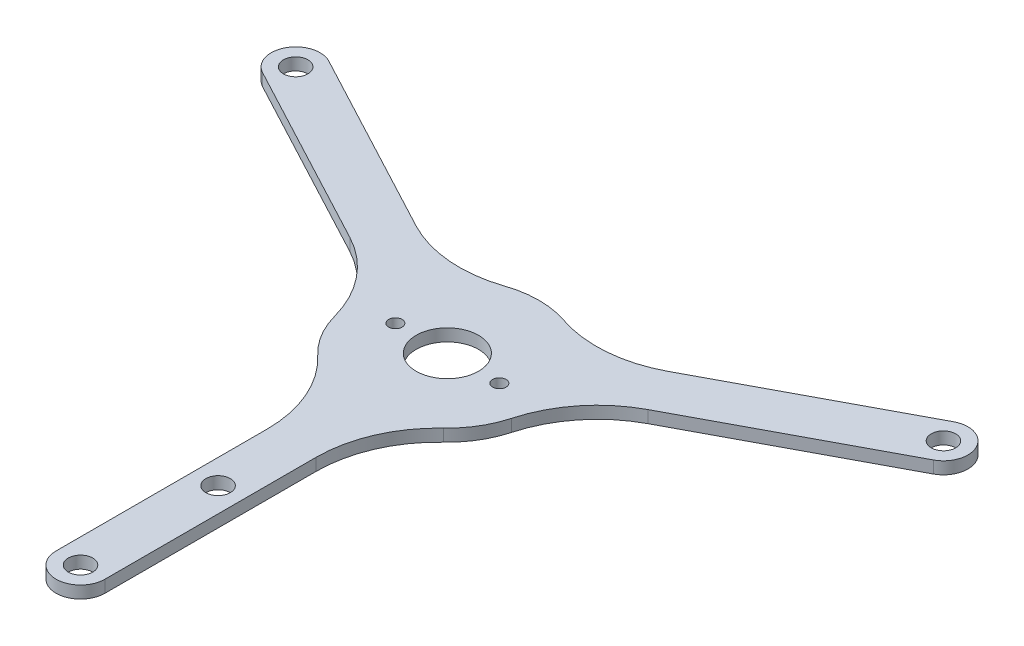
from build123d import *

# Parameters (mm, degrees)
SKETCH_1_R      = 2
SKETCH_1_R_2    = 1.1
SKETCH_1_R_3    = 5.1
EXTRUDE_1_DEPTH = 2
FILLET_1_R      = 20


with BuildPart() as part:
    # ｽｹｯﾁ1 → ﾎﾞｽ - 押し出し1 (new body)
    with BuildSketch(Plane(origin=(0, 0, 0), x_dir=(1, 0, 0), z_dir=(0, 1, 0))):
        with BuildLine():
            ThreePointArc((-51.098969856, 31.700084423), (-56.508646061, 30.046179796), (-54.854741914, 24.636503444))
            Line((-54.854741914, 24.636503444), (-14.642511526, 3.255281279))
            ThreePointArc((-14.642511526, 3.255281279), (-12.857509511, -7.725571124), (-4, -14.456832295))
            Line((-4, -14.456832295), (-4, -60))
            ThreePointArc((-4, -60), (0, -64), (4, -60))
            Line((4, -60), (4, -14.456832295))
            ThreePointArc((4, -14.456832295), (12.857509511, -7.725571124), (14.642511526, 3.255281279))
            Line((14.642511526, 3.255281279), (54.854741789, 24.636503378))
            ThreePointArc((54.854741789, 24.636503378), (56.508645811, 30.046180267), (51.098968789, 31.700083856))
            Line((51.098968789, 31.700083856), (10.886739024, 10.318862022))
            ThreePointArc((10.886739024, 10.318862022), (0, 15), (-10.886739024, 10.318862022))
            Line((-10.886739024, 10.318862022), (-51.098969856, 31.700084423))
        make_face()
        with Locations(Location((0, -60, 0), (0, 0, 270))):
            Circle(SKETCH_1_R, mode=Mode.SUBTRACT)
        with Locations(Location((0, -37.5, 0), (0, 0, 270))):
            Circle(SKETCH_1_R, mode=Mode.SUBTRACT)
        with Locations(Location((-52.976855572, 28.168293767, 0), (0, 0, 270))):
            Circle(SKETCH_1_R, mode=Mode.SUBTRACT)
        with Locations(Location((-8.5, 0, 0), (0, 0, 270))):
            Circle(SKETCH_1_R_2, mode=Mode.SUBTRACT)
        with Locations(Location((0, 0, 0), (0, 0, 270))):
            Circle(SKETCH_1_R_3, mode=Mode.SUBTRACT)
        with Locations(Location((8.5, 0, 0), (0, 0, 270))):
            Circle(SKETCH_1_R_2, mode=Mode.SUBTRACT)
        with Locations(Location((52.976855572, 28.168293767, 0), (0, 0, 270))):
            Circle(SKETCH_1_R, mode=Mode.SUBTRACT)
    extrude(amount=EXTRUDE_1_DEPTH)

    # ﾌｨﾚｯﾄ1
    fillet_1_edges = [part.edges().sort_by_distance(p)[0] for p in [
        (-4, 1, 14.456832295),
        (-14.642511526, 1, -3.255281279),
        (-10.886739024, 1, -10.318862022),
        (10.886739024, 1, -10.318862022),
        (14.642511526, 1, -3.255281279),
        (4, 1, 14.456832295),
    ]]
    fillet(fillet_1_edges, radius=FILLET_1_R)


solid = part.part
